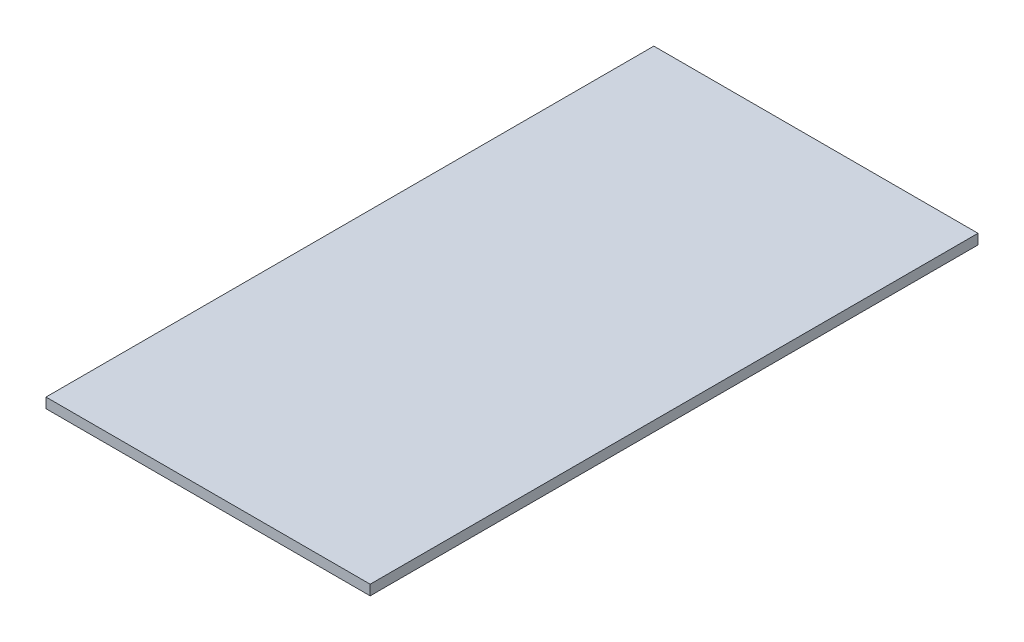
from build123d import *

# Parameters (mm, degrees)
SKETCH1_W           = 96
SKETCH1_H           = 180
BOSS_EXTRUDE1_DEPTH = 3


with BuildPart() as part:
    # Sketch1 → Boss-Extrude1 (new body)
    with BuildSketch(Plane(origin=(0, 0, 0), x_dir=(1, 0, 0), z_dir=(0, 1, 0))):
        Rectangle(SKETCH1_W, SKETCH1_H)
    extrude(amount=BOSS_EXTRUDE1_DEPTH)


solid = part.part
